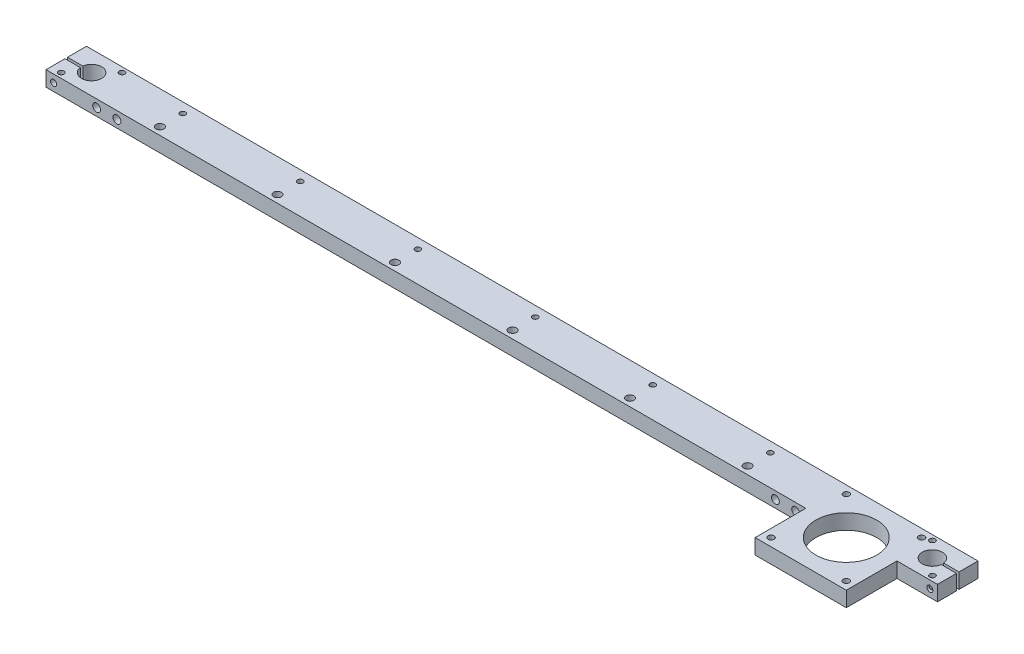
from build123d import *

# Parameters (mm, degrees)
SKETCH1_R                                      = 19.05
BOSS_EXTRUDE1_DEPTH                            = 9.525
SKETCH2_W                                      = 1.89865
SKETCH2_H                                      = 43.65625
F_10_CLEARANCE_HOLE1_D                         = 5.1054
F_10_CLEARANCE_HOLE1_DEPTH                     = 11.90625
F_10_CLEARANCE_HOLE2_D                         = 5.1054
F_10_CLEARANCE_HOLE2_DEPTH                     = 11.90625
F_10_24_TAPPED_HOLE2_D                         = 3.7973
F_10_24_TAPPED_HOLE3_D                         = 3.7973
F_10_24_TAPPED_HOLE3_DEPTH                     = 14.986
F_10_24_TAPPED_HOLE3_TIP                       = 1.140824014
CBORE_FOR_8_SOCKET_HEAD_CAP_SCREW1_D           = 4.9149
CBORE_FOR_8_SOCKET_HEAD_CAP_SCREW1_CBORE_D     = 7.9375
CBORE_FOR_8_SOCKET_HEAD_CAP_SCREW1_CBORE_DEPTH = 16.8656
CBORE_FOR_8_SOCKET_HEAD_CAP_SCREW2_D           = 4.9149
CBORE_FOR_8_SOCKET_HEAD_CAP_SCREW2_CBORE_D     = 7.9375
CBORE_FOR_8_SOCKET_HEAD_CAP_SCREW2_CBORE_DEPTH = 5.4356
F_8_32_TAPPED_HOLE1_D                          = 3.4544
F_8_32_TAPPED_HOLE1_DEPTH                      = 12.446
F_8_32_TAPPED_HOLE1_TIP                        = 1.037806461
F_8_32_TAPPED_HOLE2_D                          = 3.4544


with BuildPart() as part:
    # Sketch1 → Boss-Extrude1 (new body)
    with BuildSketch(Plane(origin=(0, 0, 0), x_dir=(1, 0, 0), z_dir=(0, 1, 0))):
        with BuildLine():
            Line((120.206642486, 6.011694636), (120.206642486, 17.917944636))
            Line((120.206642486, 17.917944636), (110.631837795, 17.917944636))
            ThreePointArc((110.631837795, 17.917944636), (97.981642486, 18.711694636), (110.631837795, 19.505444636))
            Line((110.631837795, 19.505444636), (120.206642486, 19.505444636))
            Line((120.206642486, 19.505444636), (120.206642486, 31.411694636))
            Line((120.206642486, 31.411694636), (-438.593357514, 31.411694636))
            Line((-438.593357514, 31.411694636), (-438.593357514, 19.505444636))
            Line((-438.593357514, 19.505444636), (-429.018552824, 19.505444636))
            ThreePointArc((-429.018552824, 19.505444636), (-416.368357514, 18.711694636), (-429.018552824, 17.917944636))
            Line((-429.018552824, 17.917944636), (-438.593357514, 17.917944636))
            Line((-438.593357514, 17.917944636), (-438.593357514, 6.011694636))
            Line((-438.593357514, 6.011694636), (37.656642486, 6.011694636))
            Line((37.656642486, 6.011694636), (37.656642486, -25.738305364))
            Line((37.656642486, -25.738305364), (94.806642486, -25.738305364))
            Line((94.806642486, -25.738305364), (94.806642486, 6.011694636))
            Line((94.806642486, 6.011694636), (120.206642486, 6.011694636))
        make_face()
        with Locations(Location((66.231642486, 2.836694636, 0), (0, 0, 90))):
            Circle(SKETCH1_R, mode=Mode.SUBTRACT)
    extrude(amount=BOSS_EXTRUDE1_DEPTH)

    # Sketch2 → #10-24 Tapped Hole1 (revolve, cut)
    with BuildSketch(Plane(origin=(115.444142486, 4.7625, -17.917944636), x_dir=(0, 1, 0), z_dir=(1, 0, 0))):
        with Locations((0.949325, 21.828125)):
            Rectangle(SKETCH2_W, SKETCH2_H)
    revolve(axis=Axis((115.444142486, 4.7625, -24.267944636), (0, 0, 1)), mode=Mode.SUBTRACT)

    # #10 Clearance Hole1
    with Locations(Plane(origin=(0, 0, -31.411694636), x_dir=(-1, 0, 0), z_dir=(0, 0, -1))):
        with Locations((-115.444142486, 4.7625)):
            Hole(F_10_CLEARANCE_HOLE1_D / 2, depth=F_10_CLEARANCE_HOLE1_DEPTH)

    # #10 Clearance Hole2
    with Locations(Plane(origin=(0, 0, -31.411694636), x_dir=(-1, 0, 0), z_dir=(0, 0, -1))):
        with Locations((433.830857514, 4.7625)):
            Hole(F_10_CLEARANCE_HOLE2_D / 2, depth=F_10_CLEARANCE_HOLE2_DEPTH)

    # #10-24 Tapped Hole2 (through all)
    with Locations(Plane(origin=(0, 0, -17.917944636), x_dir=(-1, 0, 0), z_dir=(0, 0, -1))):
        with Locations((433.830857514, 4.7625)):
            Hole(F_10_24_TAPPED_HOLE2_D / 2)

    # #10-24 Tapped Hole3
    with Locations(Plane(origin=(0, 0, 0), x_dir=(-1, 0, 0), z_dir=(0, -1, 0))):
        with Locations((-89.802842486, 26.407894636), (-42.660442486, 26.407894636), (-42.660442486, -20.734505364), (-89.802842486, -20.734505364)):
            Hole(F_10_24_TAPPED_HOLE3_D / 2, depth=F_10_24_TAPPED_HOLE3_DEPTH)
            with Locations((0, 0, -(F_10_24_TAPPED_HOLE3_DEPTH + F_10_24_TAPPED_HOLE3_TIP / 2))):  # 118° drill point
                Cone(0, F_10_24_TAPPED_HOLE3_D / 2, F_10_24_TAPPED_HOLE3_TIP, mode=Mode.SUBTRACT)

    # CBORE for #8 Socket Head Cap Screw1 (through all)
    with Locations(Plane(origin=(0, 0, -31.411694636), x_dir=(-1, 0, 0), z_dir=(0, 0, -1))):
        with Locations((-31.306642486, 4.7625), (-18.606642486, 4.7625), (406.843357514, 4.7625), (394.143357514, 4.7625)):
            CounterBoreHole(CBORE_FOR_8_SOCKET_HEAD_CAP_SCREW1_D / 2, CBORE_FOR_8_SOCKET_HEAD_CAP_SCREW1_CBORE_D / 2, CBORE_FOR_8_SOCKET_HEAD_CAP_SCREW1_CBORE_DEPTH)

    # CBORE for #8 Socket Head Cap Screw2 (through all)
    with Locations(Plane(origin=(0, 0, 0), x_dir=(-1, 0, 0), z_dir=(0, -1, 0))):
        with Locations((371.918357514, 10.774194636), (298.258357514, 10.774194636), (224.598357514, 10.774194636), (150.938357514, 10.774194636), (77.278357514, 10.774194636), (3.618357514, 10.774194636)):
            CounterBoreHole(CBORE_FOR_8_SOCKET_HEAD_CAP_SCREW2_D / 2, CBORE_FOR_8_SOCKET_HEAD_CAP_SCREW2_CBORE_D / 2, CBORE_FOR_8_SOCKET_HEAD_CAP_SCREW2_CBORE_DEPTH)

    # #8-32 Tapped Hole1
    with Locations(Plane(origin=(0, 0, 0), x_dir=(-1, 0, 0), z_dir=(0, -1, 0))):
        with Locations((371.918357514, 25.061694636), (298.258357514, 25.061694636), (224.598357514, 25.061694636), (150.938357514, 25.061694636), (77.278357514, 25.061694636), (3.618357514, 25.061694636)):
            Hole(F_8_32_TAPPED_HOLE1_D / 2, depth=F_8_32_TAPPED_HOLE1_DEPTH)
            with Locations((0, 0, -(F_8_32_TAPPED_HOLE1_DEPTH + F_8_32_TAPPED_HOLE1_TIP / 2))):  # 118° drill point
                Cone(0, F_8_32_TAPPED_HOLE1_D / 2, F_8_32_TAPPED_HOLE1_TIP, mode=Mode.SUBTRACT)

    # #8-32 Tapped Hole2 (through all)
    with Locations(Plane(origin=(0, 9.525, 0), x_dir=(1, 0, 0), z_dir=(0, 1, 0))):
        with Locations((113.856642486, 9.186694636), (94.806642486, 28.236694636), (-413.193357514, 28.236694636), (-432.243357514, 9.186694636)):
            Hole(F_8_32_TAPPED_HOLE2_D / 2)


solid = part.part
